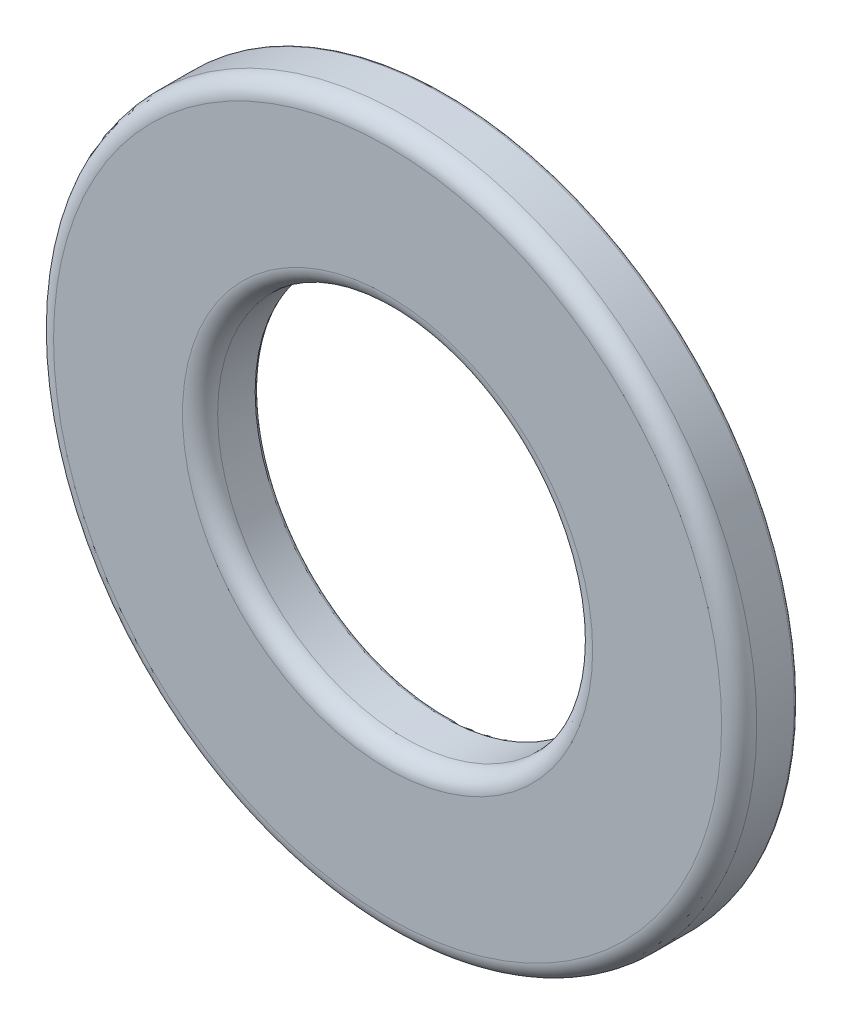
from build123d import *

# Parameters (mm, degrees)
BOSS_EXTRUDE1_DEPTH      = 0.25
BOSS_EXTRUDE1_DEPTH_BACK = 0.25
SKETCH3_R                = 3
SKETCH3_R_2              = 1.6
FILLET1_R                = 0.15
FILLET3_R                = 0.03


with BuildPart() as part:
    # Sketch3 → Boss-Extrude1 (new, two sides: drawn at the far end of the back side and taken through both)
    with BuildSketch(Plane.XY.offset(-BOSS_EXTRUDE1_DEPTH_BACK)):
        Circle(SKETCH3_R)
        Circle(SKETCH3_R_2, mode=Mode.SUBTRACT)
    extrude(amount=BOSS_EXTRUDE1_DEPTH + BOSS_EXTRUDE1_DEPTH_BACK)

    # Fillet1
    fillet1_edges = [part.edges().sort_by_distance(p)[0] for p in [
        (-3, 0, 0.25),
        (-1.6, 0, 0.25),
    ]]
    fillet(fillet1_edges, radius=FILLET1_R)

    # Fillet3
    fillet3_edges = [part.edges().sort_by_distance(p)[0] for p in [
        (-3, 0, -0.25),
        (-1.6, 0, -0.25),
    ]]
    fillet(fillet3_edges, radius=FILLET3_R)


solid = part.part
